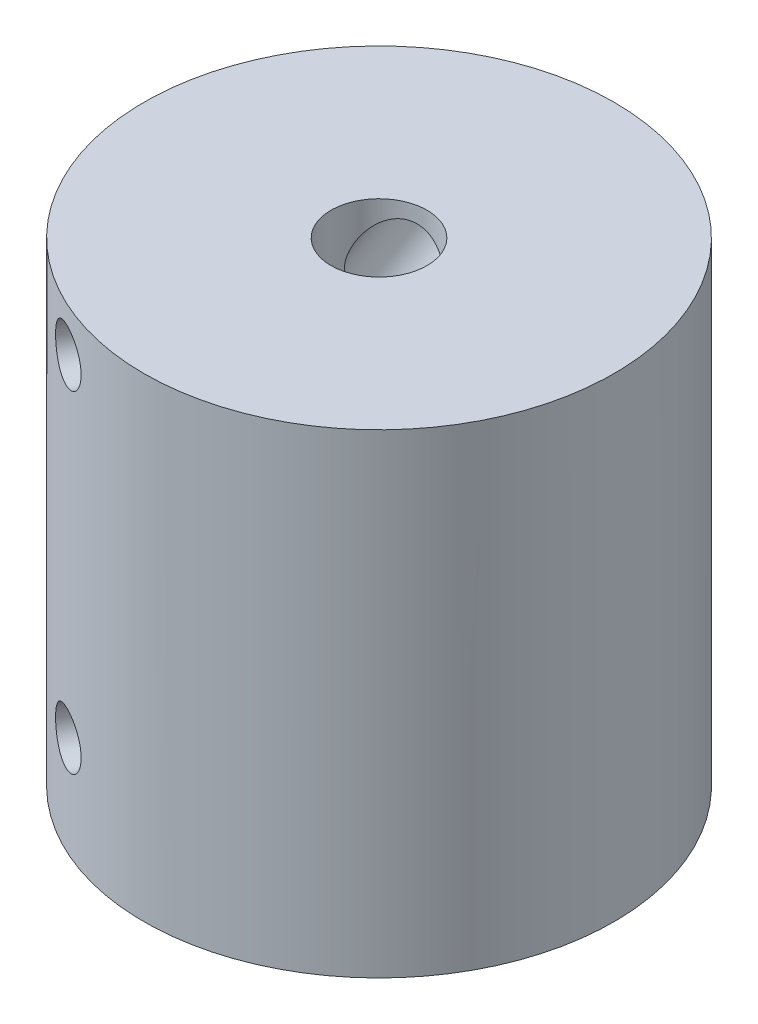
from build123d import *

# Parameters (mm, degrees)
SKETCH2_R               = 11.96975
SKETCH2_R_2             = 2.44475
BOSS_EXTRUDE1_DEPTH     = 5.588
CUT_EXTRUDE1_DEPTH      = 2.54
CUT_EXTRUDE1_DEPTH_BACK = 15
SKETCH3_R               = 1.35255
BOSS_EXTRUDE2_START     = 18.588
SKETCH4_R               = 11.96975
BOSS_EXTRUDE2_DEPTH     = 18.588
SKETCH5_R               = 2.563495
CUT_EXTRUDE3_DEPTH      = 12
CUT_EXTRUDE4_DEPTH      = 1.27
CUT_EXTRUDE4_DEPTH_BACK = 12.446
SKETCH6_R               = 1.35255
SKETCH10_R              = 2.0193
CUT_EXTRUDE6_DEPTH      = 11.43


with BuildPart() as part:
    # Sketch2 → Boss-Extrude1 (new body)
    with BuildSketch(Plane(origin=(0, 0, 0), x_dir=(1, 0, 0), z_dir=(0, 1, 0))):
        Circle(SKETCH2_R)
        Circle(SKETCH2_R_2, mode=Mode.SUBTRACT)
    extrude(amount=BOSS_EXTRUDE1_DEPTH)

    # Sketch3 → Cut-Extrude1 (cut, two sides: drawn at the far end of the back side and taken through both)
    with BuildSketch(Plane(origin=(-1.039168295, 0, 2.212901222), x_dir=(-0.9051646270437873, 0, -0.425061169655241), z_dir=(0.425061169655241, 0, -0.9051646270437873)).offset(-CUT_EXTRUDE1_DEPTH_BACK)):
        with Locations((0, 3.302)):
            Circle(SKETCH3_R)
    extrude(amount=CUT_EXTRUDE1_DEPTH + CUT_EXTRUDE1_DEPTH_BACK, mode=Mode.SUBTRACT)

    # Sketch4 → Boss-Extrude2 (add)
    with BuildSketch(Plane(origin=(0, 0, 0), x_dir=(-1, 0, 0), z_dir=(0, -1, 0)).offset(BOSS_EXTRUDE2_START)):
        Circle(SKETCH4_R)
    extrude(amount=-BOSS_EXTRUDE2_DEPTH)

    # Sketch5 → Cut-Extrude3 (cut)
    with BuildSketch(Plane(origin=(0, -18.588, 0), x_dir=(-1, 0, 0), z_dir=(0, -1, 0))):
        Circle(SKETCH5_R)
    extrude(amount=-CUT_EXTRUDE3_DEPTH, mode=Mode.SUBTRACT)

    # Sketch6 → Cut-Extrude4 (cut, two sides: drawn at the far end of the back side and taken through both)
    with BuildSketch(Plane(origin=(-1.039168295, 0, 2.212901222), x_dir=(-0.9051646270437873, 0, -0.425061169655241), z_dir=(0.425061169655241, 0, -0.9051646270437873)).offset(-CUT_EXTRUDE4_DEPTH_BACK)):
        with Locations((0, -13.588)):
            Circle(SKETCH6_R)
    extrude(amount=CUT_EXTRUDE4_DEPTH + CUT_EXTRUDE4_DEPTH_BACK, mode=Mode.SUBTRACT)

    # Sketch10 → Cut-Extrude6 (cut)
    with BuildSketch(Plane(origin=(-4.063543521, 0, -11.258886673), x_dir=(0, -1, 0), z_dir=(-0.3394844103905428, 0, -0.9406116813551624))):
        with Locations((13.762, 0)):
            Circle(SKETCH10_R)
        with Locations((-2.794, 0)):
            Circle(SKETCH10_R)
    extrude(amount=-CUT_EXTRUDE6_DEPTH, mode=Mode.SUBTRACT)


solid = part.part
